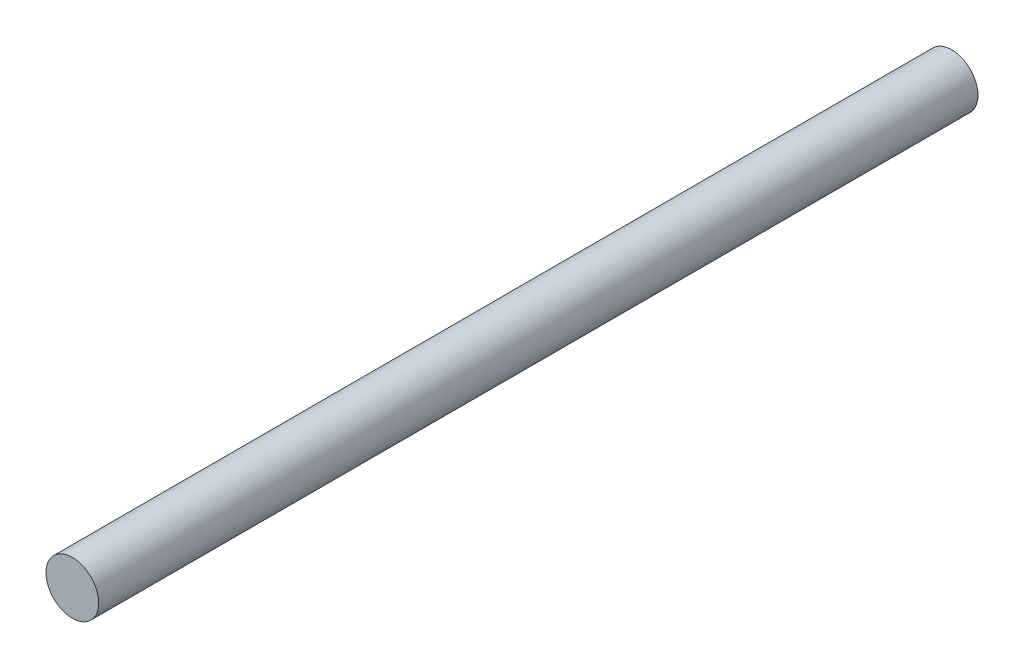
from build123d import *

# Parameters (mm, degrees)
SKETCH1_R           = 30
BOSS_EXTRUDE1_DEPTH = 1000


with BuildPart() as part:
    # Sketch1 → Boss-Extrude1 (new body)
    with BuildSketch(Plane.XY):
        Circle(SKETCH1_R)
    extrude(amount=BOSS_EXTRUDE1_DEPTH)


solid = part.part
